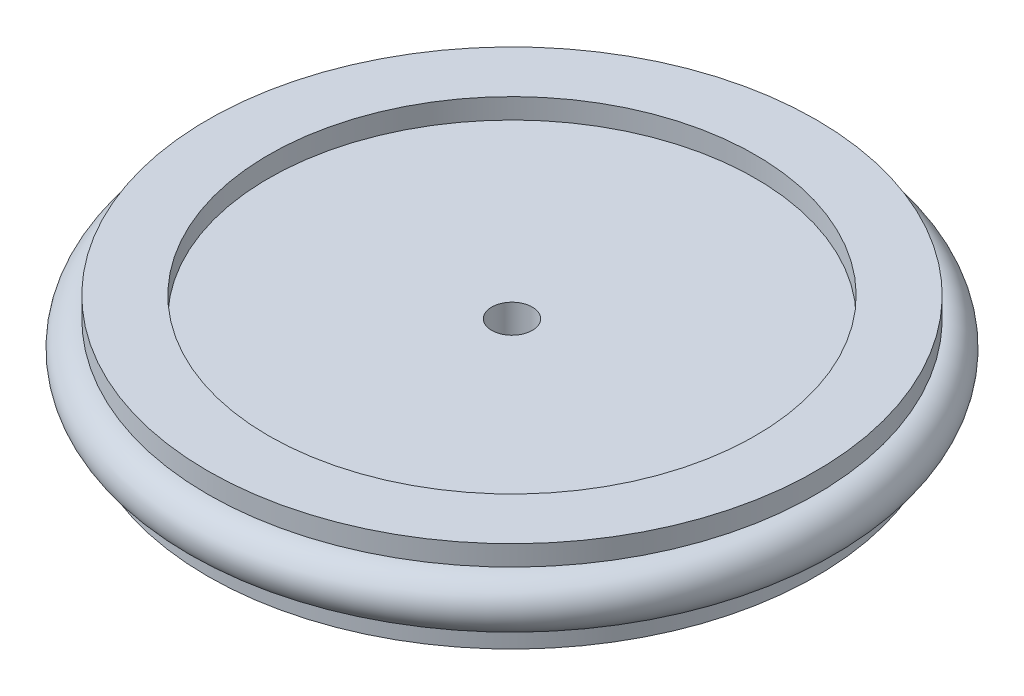
from build123d import *


with BuildPart() as part:
    # Sketch1 → Revolve1 (revolve)
    with BuildSketch(Plane.XY, mode=Mode.PRIVATE) as revolve1_sk:
        with BuildLine():
            Line((1, -2), (1, 2.5))
            Line((1, 2.5), (12, 2.5))
            Line((12, 2.5), (12, 3.5))
            Line((12, 3.5), (15, 3.5))
            Line((15, 3.5), (15, 2.5))
            ThreePointArc((15, 2.5), (16.25, 1.25), (15, 0))
            Line((15, 0), (15, -1))
            Line((15, -1), (12, -1))
            Line((12, -1), (12, 0))
            Line((12, 0), (3, 0))
            Line((3, 0), (3, -2))
            Line((3, -2), (1, -2))
        make_face()
    revolve(revolve1_sk.sketch.rotate(Axis((0, 26.353801269, 0), (0, -1, 0)), 90), axis=Axis((0, 26.353801269, 0), (0, -1, 0)))


solid = part.part
